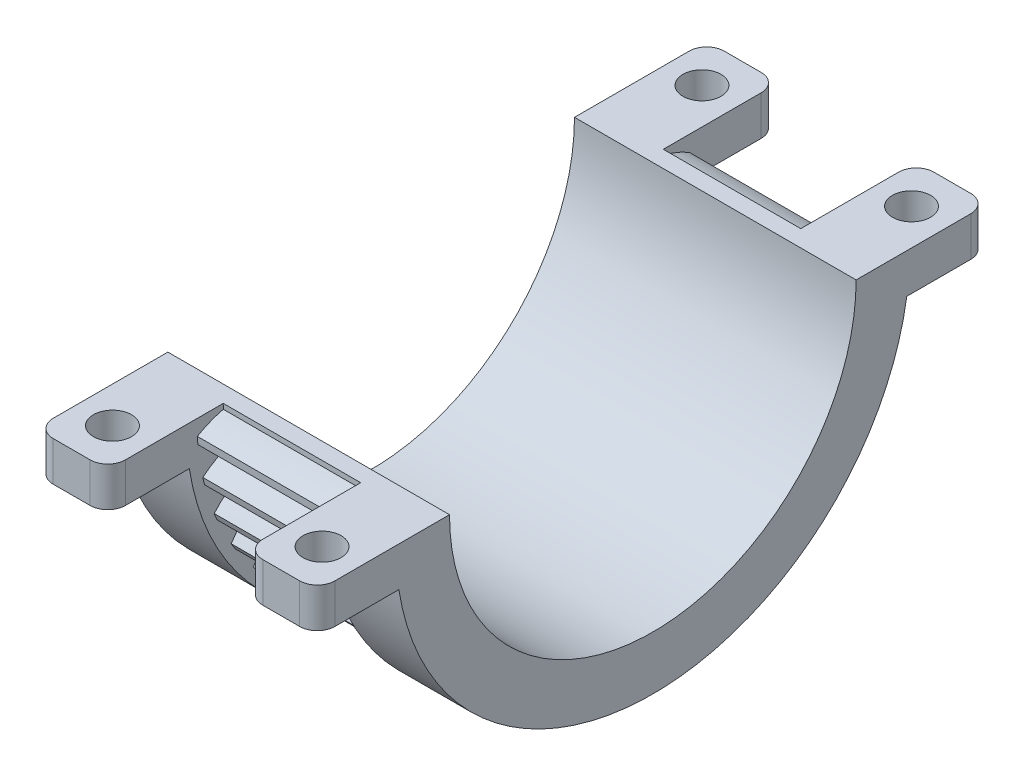
from build123d import *

# Parameters (mm, degrees)
BASPROSKE_W             = 48
BASPROSKE_H             = 42
TOOTHCUT_DEPTH          = 77.367532368
TEETHCUTS_COUNT         = 40
TEETHCUTS_ANGLE         = 351
BORSKE_R                = 32.5
BORE_DEPTH              = 50.0000508
CUT_EXTRUDE1_DEPTH      = 77.274548253
CUT_EXTRUDE1_DEPTH_BACK = 77.274548253
SKETCH1_R               = 34.65
CUT_EXTRUDE2_DEPTH      = 77.274548253
CUT_EXTRUDE2_DEPTH_BACK = 77.274548253
SKETCH2_W               = 102.897600885
SKETCH2_H               = 48.377080865
BOSS_EXTRUDE1_START     = -12.28816495
BOSS_EXTRUDE1_DEPTH     = 12.28816495
SKETCH4_R               = 3.25
CUT_EXTRUDE3_DEPTH      = 84.350383201
MIRROR3_COPY_1_SKETCH_R = 3.25
MIRROR3_COPY_1_DEPTH    = 84.350383201
FILLET1_R               = 3


with BuildPart() as part:
    # BasProSke → Base-Revolve (revolve)
    with BuildSketch(Plane(origin=(0, 0, 0), x_dir=(1, 0, 0), z_dir=(0, 1, 0)), mode=Mode.PRIVATE) as base_revolve_sk:
        with Locations((24, 21)):
            Rectangle(BASPROSKE_W, BASPROSKE_H)
    revolve(base_revolve_sk.sketch.rotate(Axis((-10, 0, 0), (1, 0, 0)), 180), axis=Axis((-10, 0, 0), (1, 0, 0)))

    # TooCutSke → ToothCut (cut, through all)
    with BuildSketch(Plane(origin=(0, 0, 0), x_dir=(0, 0, -1), z_dir=(1, 0, 0))):
        with BuildLine():
            ThreePointArc((0.882812088, 37.488606854), (0, 37.499), (-0.882812088, 37.488606854))
            ThreePointArc((-0.882812088, 37.488606854), (-1.612748684, 39.782000434), (-2.678427154, 41.939960338))
            ThreePointArc((-2.678427154, 41.939960338), (0, 42.0254), (2.678427154, 41.939960338))
            ThreePointArc((2.678427154, 41.939960338), (1.612748684, 39.782000434), (0.882812088, 37.488606854))
        make_face()
    toothcut = extrude(amount=TOOTHCUT_DEPTH, mode=Mode.SUBTRACT)

    # TeethCuts: ToothCut ×40 about axis
    teethcuts_axis = Axis((-10, 0, 0), (1, 0, 0))
    for i in range(1, TEETHCUTS_COUNT):
        add(toothcut.rotate(teethcuts_axis, i * TEETHCUTS_ANGLE / (TEETHCUTS_COUNT - 1)), mode=Mode.SUBTRACT)

    # BorSke → Bore (cut, symmetric)
    with BuildSketch(Plane(origin=(0, 0, 0), x_dir=(0, 0, -1), z_dir=(1, 0, 0))):
        with Locations(Location((0, 0, 0), (0, 0, 180))):
            Circle(BORSKE_R)
    extrude(amount=BORE_DEPTH, both=True, mode=Mode.SUBTRACT)

    # Sketch1 → Cut-Extrude1 (cut, two sides: drawn at the far end of the back side and taken through both)
    with BuildSketch(Plane.ZY.offset(-CUT_EXTRUDE1_DEPTH_BACK)):
        Circle(SKETCH1_R)
    extrude(amount=CUT_EXTRUDE1_DEPTH + CUT_EXTRUDE1_DEPTH_BACK, mode=Mode.SUBTRACT)

    # Sketch2 → Cut-Extrude2 (cut, two sides: drawn at the far end of the back side and taken through both)
    with BuildSketch(Plane(origin=(48, 0, 0), x_dir=(0, 0, -1), z_dir=(1, 0, 0)).offset(-CUT_EXTRUDE2_DEPTH_BACK)):
        with Locations((0.168316686, 24.188540433)):
            Rectangle(SKETCH2_W, SKETCH2_H)
    extrude(amount=CUT_EXTRUDE2_DEPTH + CUT_EXTRUDE2_DEPTH_BACK, mode=Mode.SUBTRACT)

    # Sketch3 → Boss-Extrude1 (add)
    with BuildSketch(Plane(origin=(48, 0, 0), x_dir=(0, 0, -1), z_dir=(1, 0, 0)).offset(BOSS_EXTRUDE1_START)):
        with BuildLine():
            Line((34.65, 0), (57.182596138, 0))
            Line((57.182596138, 0), (57.182596138, -6.740320101))
            Line((57.182596138, -6.740320101), (43.278498338, -6.740320101))
            ThreePointArc((43.278498338, -6.740320101), (0, -43.800232116), (-43.278498338, -6.740320101))
            Line((-43.278498338, -6.740320101), (-57.182596138, -6.740320101))
            Line((-57.182596138, -6.740320101), (-57.182596138, 0))
            Line((-57.182596138, 0), (-34.65, 0))
            ThreePointArc((-34.65, 0), (0, -34.65), (34.65, 0))
        make_face()
    boss_extrude1 = extrude(amount=BOSS_EXTRUDE1_DEPTH)

    # Mirror1: Boss-Extrude1 across plane
    add(boss_extrude1.mirror(Plane(origin=(24, 0, 0), x_dir=(0, 0, 1), z_dir=(1, 0, 0))))

    # Sketch4 → Cut-Extrude3 (cut, symmetric)
    with BuildSketch(Plane.XZ.offset(6.740320101)):
        with Locations(Location((41.855917525, 50.230547238, 0), (0, 0, 270))):
            Circle(SKETCH4_R)
    cut_extrude3 = extrude(amount=CUT_EXTRUDE3_DEPTH, both=True, mode=Mode.SUBTRACT)

    # Mirror2: Cut-Extrude3 across plane
    add(cut_extrude3.mirror(Plane.XY), mode=Mode.SUBTRACT)

    # Mirror3: Cut-Extrude3 across plane
    add(cut_extrude3.mirror(Plane(origin=(24, 0, 0), x_dir=(0, 0, 1), z_dir=(1, 0, 0))), mode=Mode.SUBTRACT)

    # Mirror3 copy 1 sketch → Mirror3 copy 1 (cut, symmetric)
    with BuildSketch(Plane(origin=(48, -6.740320101, 0), x_dir=(-1, 0, 0), z_dir=(0, -1, 0))):
        with Locations(Location((41.855917525, 50.230547238, 0), (0, 0, 270))):
            Circle(MIRROR3_COPY_1_SKETCH_R)
    extrude(amount=MIRROR3_COPY_1_DEPTH, both=True, mode=Mode.SUBTRACT)

    # Fillet1
    fillet1_edges = [part.edges().sort_by_distance(p)[0] for p in [
        (0, -3.37016005, -57.182596138),
        (0, -3.37016005, 57.182596138),
        (12.28816495, -3.37016005, 57.182596138),
        (12.28816495, -3.37016005, -57.182596138),
        (35.71183505, -3.37016005, -57.182596138),
        (35.71183505, -3.37016005, 57.182596138),
        (48, -3.37016005, 57.182596138),
        (48, -3.37016005, -57.182596138),
    ]]
    fillet(fillet1_edges, radius=FILLET1_R)


solid = part.part
